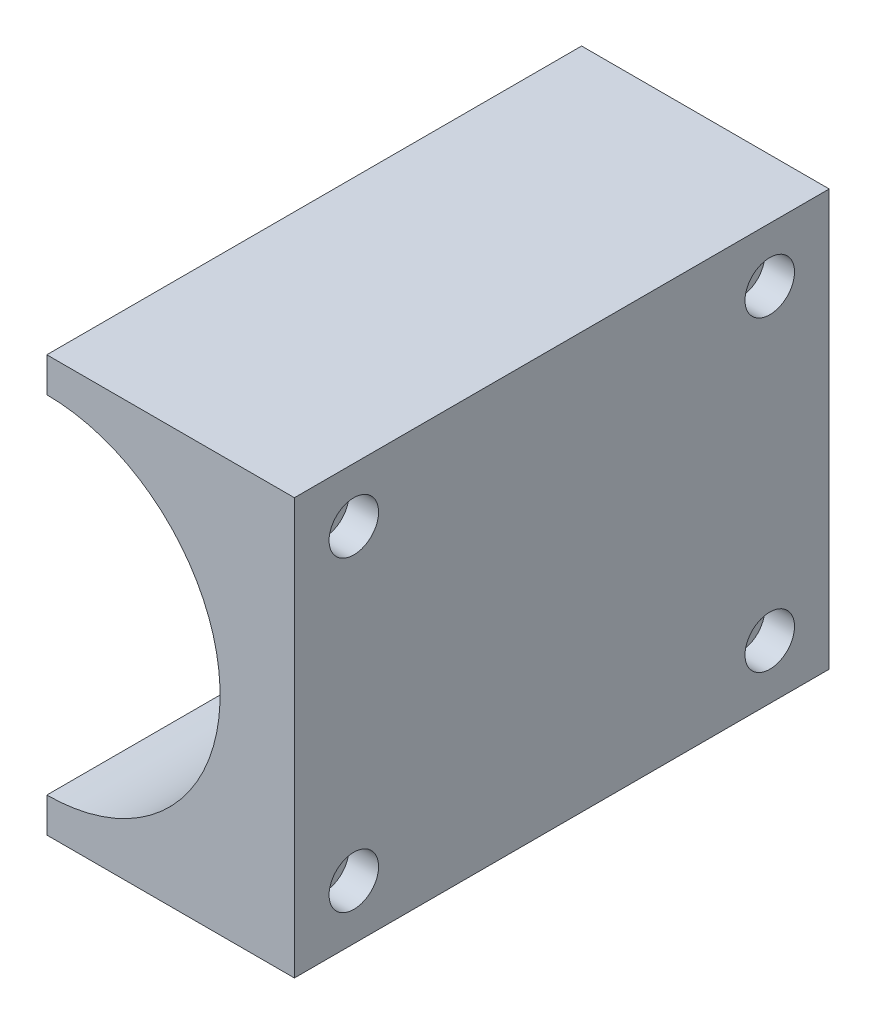
from build123d import *

# Parameters (mm, degrees)
SKETCH1_W           = 25
SKETCH1_H           = 42
BOSS_EXTRUDE1_DEPTH = 54
CUT_EXTRUDE1_START  = -28
SKETCH2_R           = 18.5
CUT_EXTRUDE1_DEPTH  = 28
CUT_EXTRUDE2_REACH  = 64.714
SKETCH3_R           = 17.5
SKETCH4_R           = 2.5
CUT_EXTRUDE3_DEPTH  = 3


with BuildPart() as part:
    # Sketch1 → Boss-Extrude1 (new body)
    with BuildSketch(Plane.XY):
        with Locations((11.5, 0)):
            Rectangle(SKETCH1_W, SKETCH1_H)
    extrude(amount=-BOSS_EXTRUDE1_DEPTH)

    # Sketch2 → Cut-Extrude1 (cut)
    with BuildSketch(Plane(origin=(0, 0, -54), x_dir=(-1, 0, 0), z_dir=(0, 0, -1)).offset(CUT_EXTRUDE1_START)):
        with Locations((1, 0)):
            Circle(SKETCH2_R)
    extrude(amount=CUT_EXTRUDE1_DEPTH, mode=Mode.SUBTRACT)

    # Sketch3 → Cut-Extrude2 (cut, up to next)
    with BuildSketch(Plane.XY, mode=Mode.PRIVATE) as cut_extrude2_sk1:
        with Locations((-1, 0)):
            Circle(SKETCH3_R)
    cut_extrude2_tool1 = extrude(cut_extrude2_sk1.sketch, amount=-CUT_EXTRUDE2_REACH, mode=Mode.PRIVATE) & part.part
    add(cut_extrude2_tool1.solids().sort_by_distance((-1, 0, 0))[0], mode=Mode.SUBTRACT)

    # Sketch4 → Cut-Extrude3 (cut)
    with BuildSketch(Plane(origin=(24, 0, 0), x_dir=(0, 0, -1), z_dir=(1, 0, 0))):
        with Locations(Location((6, 15.5, 0), (0, 0, 90))):
            Circle(SKETCH4_R)
        with Locations(Location((48, 15.5, 0), (0, 0, 90))):
            Circle(SKETCH4_R)
        with Locations(Location((6, -15.5, 0), (0, 0, 90))):
            Circle(SKETCH4_R)
        with Locations(Location((48, -15.5, 0), (0, 0, 90))):
            Circle(SKETCH4_R)
    extrude(amount=-CUT_EXTRUDE3_DEPTH, mode=Mode.SUBTRACT)


solid = part.part
